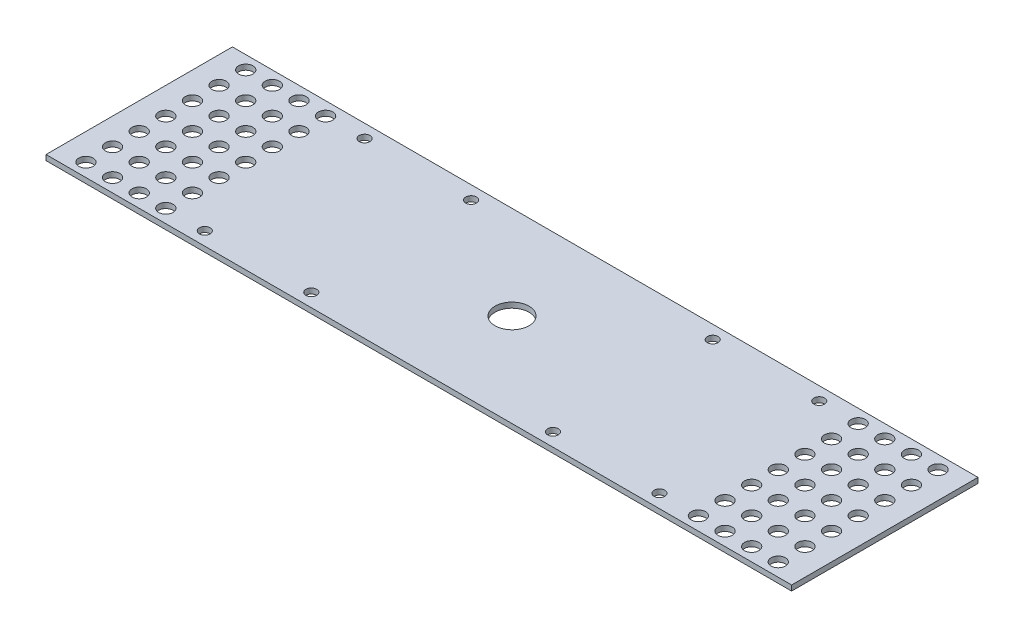
from build123d import *

# Parameters (mm, degrees)
SKETCH1_W           = 355.6
SKETCH1_H           = 609.6
BOSS_EXTRUDE1_DEPTH = 2.54
SKETCH2_R           = 2.5527
SKETCH2_R_2         = 3.429
SKETCH2_W           = 355.6
SKETCH2_H           = 146.05
SKETCH2_H_2         = 374.65
CUT_EXTRUDE1_DEPTH  = 491.562056829
SKETCH3_R           = 8.101339051
CUT_EXTRUDE2_DEPTH  = 197.045387857


with BuildPart() as part:
    # Sketch1 → Boss-Extrude1 (new body)
    with BuildSketch(Plane(origin=(0, 0, 0), x_dir=(1, 0, 0), z_dir=(0, 1, 0))):
        with Locations((0, -152.4)):
            Rectangle(SKETCH1_W, SKETCH1_H)
    extrude(amount=BOSS_EXTRUDE1_DEPTH)

    # Sketch2 → Cut-Extrude1 (cut, through all)
    with BuildSketch(Plane(origin=(0, 2.54, 0), x_dir=(1, 0, 0), z_dir=(0, 1, 0))):
        with Locations(Location((-108.42244, 0, 0), (0, 0, 270))):
            Circle(SKETCH2_R)
        with Locations(Location((-57.62244, 0, 0), (0, 0, 270))):
            Circle(SKETCH2_R)
        with Locations(Location((-57.62244, -76.2, 0), (0, 0, 270))):
            Circle(SKETCH2_R)
        with Locations(Location((-108.42244, -76.2, 0), (0, 0, 270))):
            Circle(SKETCH2_R)
        with Locations(Location((108.42244, -76.2, 0), (0, 0, 90))):
            Circle(SKETCH2_R)
        with Locations(Location((57.62244, -76.2, 0), (0, 0, 90))):
            Circle(SKETCH2_R)
        with Locations(Location((57.62244, 0, 0), (0, 0, 90))):
            Circle(SKETCH2_R)
        with Locations(Location((108.42244, 0, 0), (0, 0, 90))):
            Circle(SKETCH2_R)
        with Locations(Location((-139.7, 0, 0), (0, 0, 270))):
            Circle(SKETCH2_R_2)
        with Locations(Location((-127, 0, 0), (0, 0, 270))):
            Circle(SKETCH2_R_2)
        with Locations(Location((-139.7, -12.7, 0), (0, 0, 270))):
            Circle(SKETCH2_R_2)
        with Locations(Location((-127, -12.7, 0), (0, 0, 270))):
            Circle(SKETCH2_R_2)
        with Locations(Location((-139.7, -25.4, 0), (0, 0, 270))):
            Circle(SKETCH2_R_2)
        with Locations(Location((-127, -25.4, 0), (0, 0, 270))):
            Circle(SKETCH2_R_2)
        with Locations(Location((-139.7, -38.1, 0), (0, 0, 270))):
            Circle(SKETCH2_R_2)
        with Locations(Location((-127, -38.1, 0), (0, 0, 270))):
            Circle(SKETCH2_R_2)
        with Locations(Location((-139.7, -50.8, 0), (0, 0, 270))):
            Circle(SKETCH2_R_2)
        with Locations(Location((-127, -50.8, 0), (0, 0, 270))):
            Circle(SKETCH2_R_2)
        with Locations(Location((-139.7, -63.5, 0), (0, 0, 270))):
            Circle(SKETCH2_R_2)
        with Locations(Location((-165.1, 0, 0), (0, 0, 270))):
            Circle(SKETCH2_R_2)
        with Locations(Location((-152.4, 0, 0), (0, 0, 270))):
            Circle(SKETCH2_R_2)
        with Locations(Location((-152.4, -12.7, 0), (0, 0, 270))):
            Circle(SKETCH2_R_2)
        with Locations(Location((-152.4, -25.4, 0), (0, 0, 270))):
            Circle(SKETCH2_R_2)
        with Locations(Location((-152.4, -38.1, 0), (0, 0, 270))):
            Circle(SKETCH2_R_2)
        with Locations(Location((-152.4, -50.8, 0), (0, 0, 270))):
            Circle(SKETCH2_R_2)
        with Locations(Location((-152.4, -63.5, 0), (0, 0, 270))):
            Circle(SKETCH2_R_2)
        with Locations(Location((-152.4, -76.2, 0), (0, 0, 270))):
            Circle(SKETCH2_R_2)
        with Locations(Location((-165.1, -12.7, 0), (0, 0, 270))):
            Circle(SKETCH2_R_2)
        with Locations(Location((-165.1, -25.4, 0), (0, 0, 270))):
            Circle(SKETCH2_R_2)
        with Locations(Location((-165.1, -38.1, 0), (0, 0, 270))):
            Circle(SKETCH2_R_2)
        with Locations(Location((-165.1, -50.8, 0), (0, 0, 270))):
            Circle(SKETCH2_R_2)
        with Locations(Location((-165.1, -63.5, 0), (0, 0, 270))):
            Circle(SKETCH2_R_2)
        with Locations(Location((-165.1, -76.2, 0), (0, 0, 270))):
            Circle(SKETCH2_R_2)
        with Locations(Location((-127, -63.5, 0), (0, 0, 270))):
            Circle(SKETCH2_R_2)
        with Locations(Location((-139.7, -76.2, 0), (0, 0, 270))):
            Circle(SKETCH2_R_2)
        with Locations(Location((-127, -76.2, 0), (0, 0, 270))):
            Circle(SKETCH2_R_2)
        with Locations(Location((127, -76.2, 0), (0, 0, 90))):
            Circle(SKETCH2_R_2)
        with Locations(Location((139.7, -76.2, 0), (0, 0, 90))):
            Circle(SKETCH2_R_2)
        with Locations(Location((127, -63.5, 0), (0, 0, 90))):
            Circle(SKETCH2_R_2)
        with Locations(Location((165.1, -76.2, 0), (0, 0, 90))):
            Circle(SKETCH2_R_2)
        with Locations(Location((165.1, -63.5, 0), (0, 0, 90))):
            Circle(SKETCH2_R_2)
        with Locations(Location((165.1, -50.8, 0), (0, 0, 90))):
            Circle(SKETCH2_R_2)
        with Locations(Location((165.1, -38.1, 0), (0, 0, 90))):
            Circle(SKETCH2_R_2)
        with Locations(Location((165.1, -25.4, 0), (0, 0, 90))):
            Circle(SKETCH2_R_2)
        with Locations(Location((165.1, -12.7, 0), (0, 0, 90))):
            Circle(SKETCH2_R_2)
        with Locations(Location((152.4, -76.2, 0), (0, 0, 90))):
            Circle(SKETCH2_R_2)
        with Locations(Location((152.4, -63.5, 0), (0, 0, 90))):
            Circle(SKETCH2_R_2)
        with Locations(Location((152.4, -50.8, 0), (0, 0, 90))):
            Circle(SKETCH2_R_2)
        with Locations(Location((152.4, -38.1, 0), (0, 0, 90))):
            Circle(SKETCH2_R_2)
        with Locations(Location((152.4, -25.4, 0), (0, 0, 90))):
            Circle(SKETCH2_R_2)
        with Locations(Location((152.4, -12.7, 0), (0, 0, 90))):
            Circle(SKETCH2_R_2)
        with Locations(Location((152.4, 0, 0), (0, 0, 90))):
            Circle(SKETCH2_R_2)
        with Locations(Location((165.1, 0, 0), (0, 0, 90))):
            Circle(SKETCH2_R_2)
        with Locations(Location((139.7, -63.5, 0), (0, 0, 90))):
            Circle(SKETCH2_R_2)
        with Locations(Location((127, -50.8, 0), (0, 0, 90))):
            Circle(SKETCH2_R_2)
        with Locations(Location((139.7, -50.8, 0), (0, 0, 90))):
            Circle(SKETCH2_R_2)
        with Locations(Location((127, -38.1, 0), (0, 0, 90))):
            Circle(SKETCH2_R_2)
        with Locations(Location((139.7, -38.1, 0), (0, 0, 90))):
            Circle(SKETCH2_R_2)
        with Locations(Location((127, -25.4, 0), (0, 0, 90))):
            Circle(SKETCH2_R_2)
        with Locations(Location((139.7, -25.4, 0), (0, 0, 90))):
            Circle(SKETCH2_R_2)
        with Locations(Location((127, -12.7, 0), (0, 0, 90))):
            Circle(SKETCH2_R_2)
        with Locations(Location((139.7, -12.7, 0), (0, 0, 90))):
            Circle(SKETCH2_R_2)
        with Locations(Location((127, 0, 0), (0, 0, 90))):
            Circle(SKETCH2_R_2)
        with Locations(Location((139.7, 0, 0), (0, 0, 90))):
            Circle(SKETCH2_R_2)
        with Locations((0, 79.375)):
            Rectangle(SKETCH2_W, SKETCH2_H)
        with Locations((0, -269.875)):
            Rectangle(SKETCH2_W, SKETCH2_H_2)
    extrude(amount=-CUT_EXTRUDE1_DEPTH, mode=Mode.SUBTRACT)

    # Sketch3 → Cut-Extrude2 (cut, through all)
    with BuildSketch(Plane(origin=(0, 2.54, 0), x_dir=(1, 0, 0), z_dir=(0, 1, 0))):
        with Locations(Location((0, -38.1, 0), (0, 0, 270))):
            Circle(SKETCH3_R)
    extrude(amount=-CUT_EXTRUDE2_DEPTH, mode=Mode.SUBTRACT)


solid = part.part
